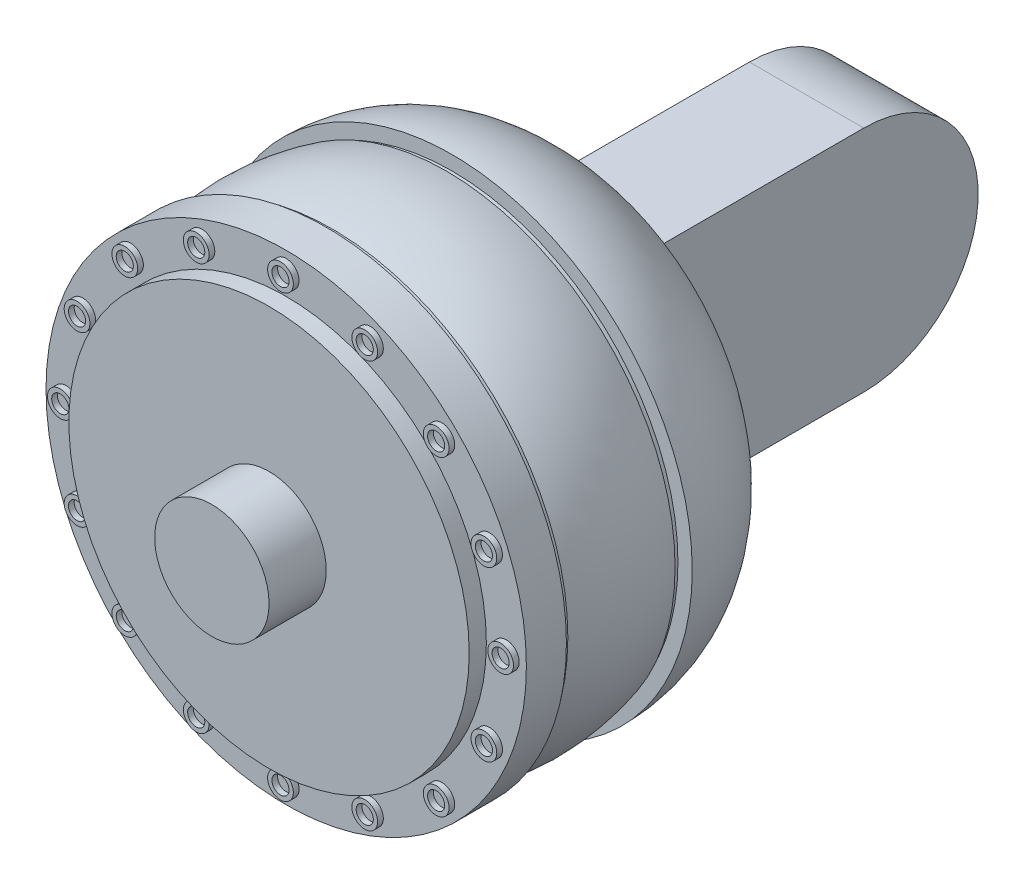
from build123d import *

# Parameters (mm, degrees)
SKETCH2_R           = 39.5
BOSS_EXTRUDE1_DEPTH = 1
SKETCH4_R           = 41.25
BOSS_EXTRUDE2_DEPTH = 1
SKETCH5_R           = 42
BOSS_EXTRUDE3_DEPTH = 7
SKETCH6_R           = 35
BOSS_EXTRUDE4_DEPTH = 3
SKETCH7_R           = 2.25
SKETCH7_R_2         = 1.5
BOSS_EXTRUDE5_DEPTH = 1
CIRPATTERN1_COUNT   = 16
SKETCH8_W           = 20
SKETCH8_H           = 40
BOSS_EXTRUDE6_DEPTH = 42
SKETCH9_R           = 20
BOSS_EXTRUDE7_DEPTH = 20
SKETCH10_R          = 10
BOSS_EXTRUDE8_DEPTH = 10
SKETCH11_R          = 10
BOSS_EXTRUDE9_DEPTH = 10


with BuildPart() as part:
    # Sketch1 → Revolve1 (revolve)
    with BuildSketch(Plane(origin=(0, 0, 0), x_dir=(1, 0, 0), z_dir=(0, 1, 0))):
        with BuildLine():
            Line((0, 0), (0, -20))
            Line((0, -20), (-42, -20))
            ThreePointArc((-42, -20), (-39.360679775, -8.819660113), (-32, 0))
            Line((-32, 0), (0, 0))
        make_face()
    revolve(axis=Axis((0, 0, 0), (0, 0, 1)))

    # Sketch2 → Boss-Extrude1 (add)
    with BuildSketch(Plane.XY.offset(20)):
        Circle(SKETCH2_R)
    extrude(amount=BOSS_EXTRUDE1_DEPTH)

    # Sketch3 → Revolve3 (revolve)
    with BuildSketch(Plane(origin=(0, 0, 0), x_dir=(1, 0, 0), z_dir=(0, 1, 0))):
        with BuildLine():
            Line((0, -21), (-40, -21))
            ThreePointArc((-40, -21), (-41.376973739, -31), (-40, -41))
            Line((-40, -41), (0, -41))
            Line((0, -41), (0, -21))
        make_face()
    revolve(axis=Axis((0, 0, 21), (0, 0, 1)))

    # Sketch4 → Boss-Extrude2 (add)
    with BuildSketch(Plane.XY.offset(41)):
        Circle(SKETCH4_R)
    extrude(amount=BOSS_EXTRUDE2_DEPTH)

    # Sketch5 → Boss-Extrude3 (add)
    with BuildSketch(Plane.XY.offset(42)):
        Circle(SKETCH5_R)
    extrude(amount=BOSS_EXTRUDE3_DEPTH)

    # Sketch6 → Boss-Extrude4 (add)
    with BuildSketch(Plane.XY.offset(49)):
        Circle(SKETCH6_R)
    extrude(amount=BOSS_EXTRUDE4_DEPTH)

    # Sketch7 → Boss-Extrude5 (add)
    with BuildSketch(Plane.XY.offset(49)):
        with Locations((38.5, 0)):
            Circle(SKETCH7_R)
        with Locations((38.5, 0)):
            Circle(SKETCH7_R_2, mode=Mode.SUBTRACT)
    boss_extrude5 = extrude(amount=BOSS_EXTRUDE5_DEPTH)

    # CirPattern1: Boss-Extrude5 ×16 about axis
    cirpattern1_axis = Axis((0, 0, 0), (0, 0, 1))
    for i in range(1, CIRPATTERN1_COUNT):
        add(boss_extrude5.rotate(cirpattern1_axis, i * 360 / CIRPATTERN1_COUNT))

    # Sketch8 → Boss-Extrude6 (add)
    with BuildSketch(Plane(origin=(0, 0, 0), x_dir=(-1, 0, 0), z_dir=(0, 0, -1))):
        Rectangle(SKETCH8_W, SKETCH8_H)
    extrude(amount=BOSS_EXTRUDE6_DEPTH)

    # Sketch9 → Boss-Extrude7 (add)
    with BuildSketch(Plane.ZY.offset(10)):
        with Locations((-42, 0)):
            Circle(SKETCH9_R)
    extrude(amount=-BOSS_EXTRUDE7_DEPTH)

    # Sketch10 → Boss-Extrude8 (add)
    with BuildSketch(Plane.ZY.offset(10)):
        with Locations(Location((-42, 0, 0), (0, 0, 180))):
            Circle(SKETCH10_R)
    extrude(amount=BOSS_EXTRUDE8_DEPTH)

    # Sketch11 → Boss-Extrude9 (add)
    with BuildSketch(Plane.XY.offset(52)):
        Circle(SKETCH11_R)
    extrude(amount=BOSS_EXTRUDE9_DEPTH)


solid = part.part
